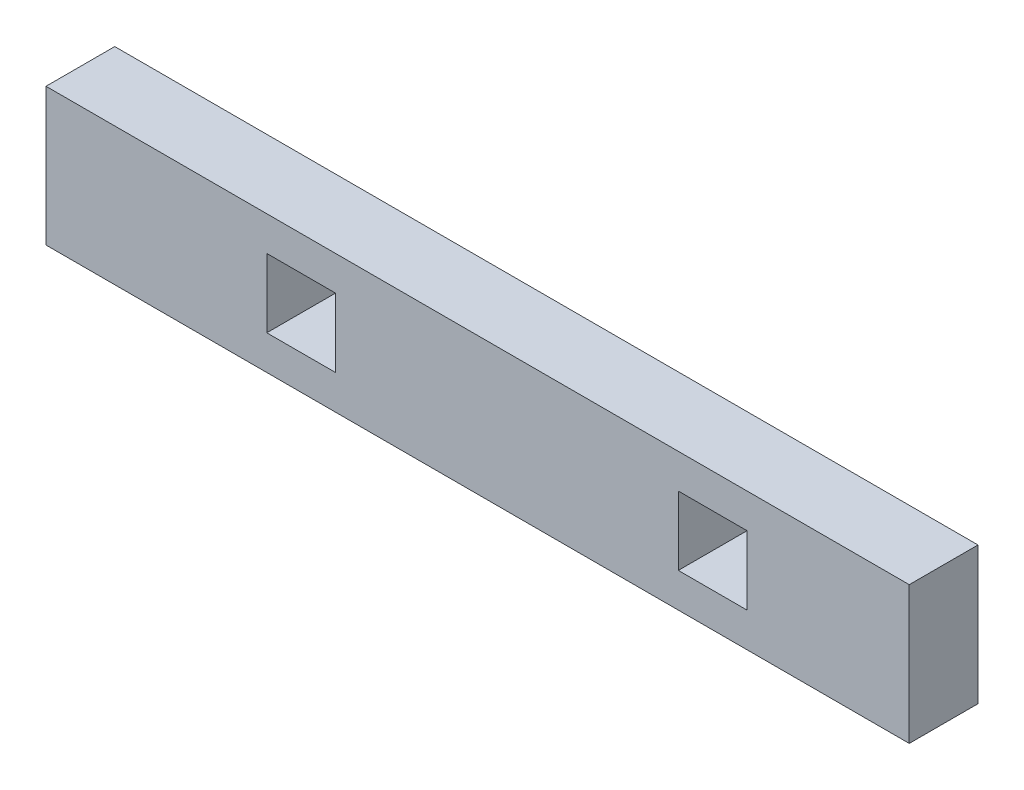
from build123d import *

# Parameters (mm, degrees)
SKETCH1_W           = 39.86221147
SKETCH1_H           = 6.35
SKETCH1_W_2         = 3.175
SKETCH1_H_2         = 3.175
BOSS_EXTRUDE1_DEPTH = 3.175


with BuildPart() as part:
    # Sketch1 → Boss-Extrude1 (new body)
    with BuildSketch(Plane.XY):
        with Locations((43.507685092, -0.004486266)):
            Rectangle(SKETCH1_W, SKETCH1_H)
        with Locations((54.362348302, -0.004486266)):
            Rectangle(SKETCH1_W_2, SKETCH1_H_2, mode=Mode.SUBTRACT)
        with Locations((35.358431187, -0.004486266)):
            Rectangle(SKETCH1_W_2, SKETCH1_H_2, mode=Mode.SUBTRACT)
    extrude(amount=-BOSS_EXTRUDE1_DEPTH)


solid = part.part
